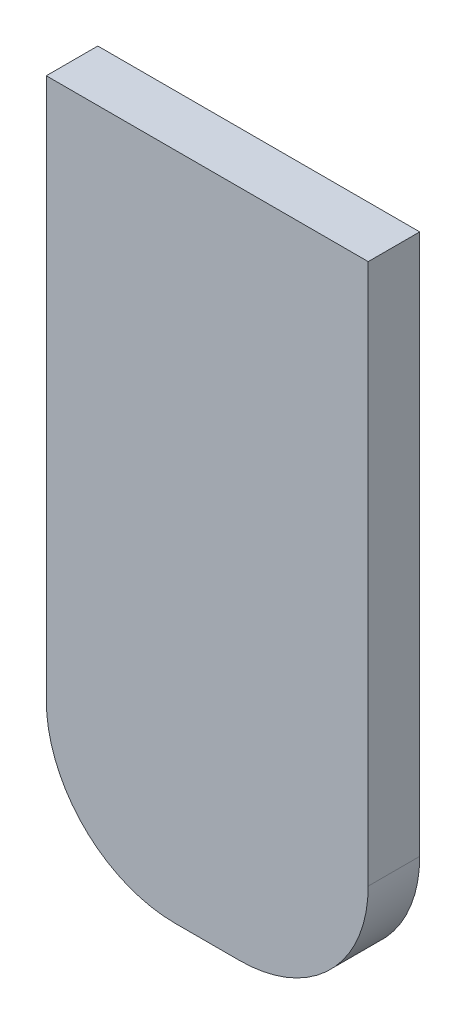
from build123d import *

# Parameters (mm, degrees)
SKETCH1_W           = 31.75
SKETCH1_H           = 66.04
BOSS_EXTRUDE1_DEPTH = 5.08
FILLET1_R           = 12.7


with BuildPart() as part:
    # Sketch1 → Boss-Extrude1 (new body)
    with BuildSketch(Plane.XY):
        with Locations((15.875, 33.02)):
            Rectangle(SKETCH1_W, SKETCH1_H)
    extrude(amount=BOSS_EXTRUDE1_DEPTH)

    # Fillet1
    fillet1_edges = [part.edges().sort_by_distance(p)[0] for p in [
        (31.75, 0, 2.54),
        (0, 0, 2.54),
    ]]
    fillet(fillet1_edges, radius=FILLET1_R)


solid = part.part
